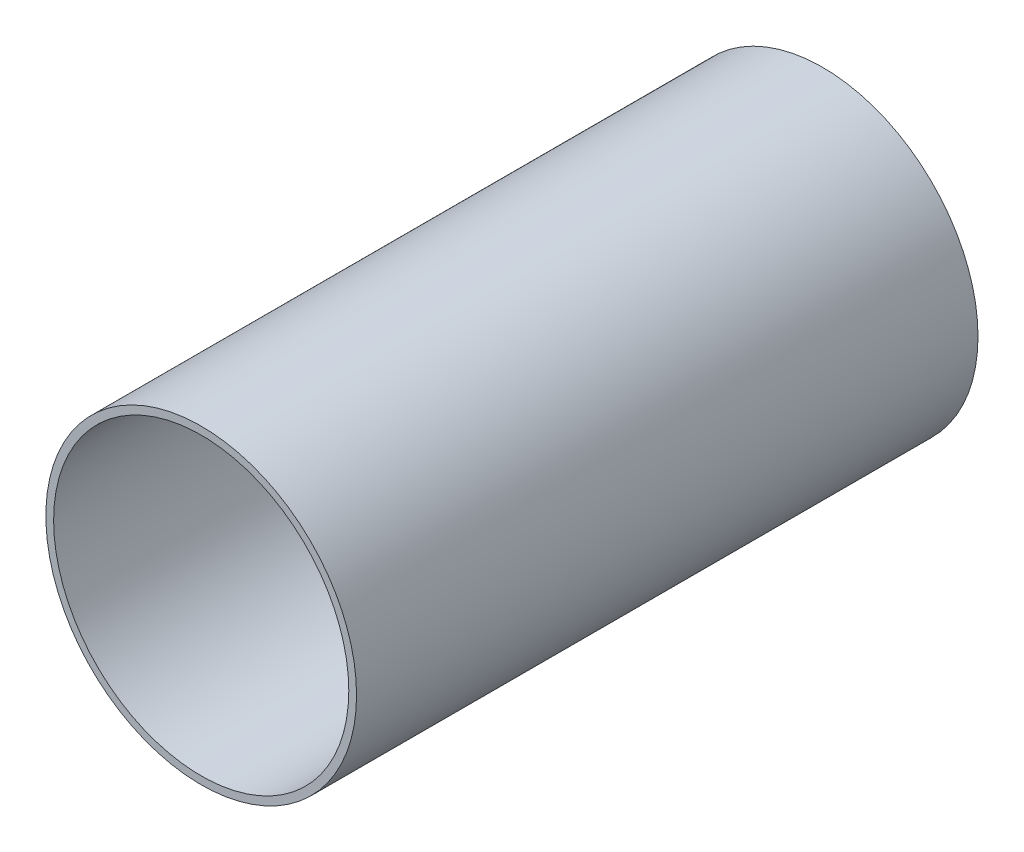
from build123d import *

# Parameters (mm, degrees)
SKETCH_6_R      = 100
SKETCH_6_R_2    = 95
EXTRUDE_1_DEPTH = 400


with BuildPart() as part:
    # 草图6 → 凸台-拉伸1 (new body)
    with BuildSketch(Plane.XY):
        Circle(SKETCH_6_R)
        Circle(SKETCH_6_R_2, mode=Mode.SUBTRACT)
    extrude(amount=EXTRUDE_1_DEPTH)


solid = part.part
